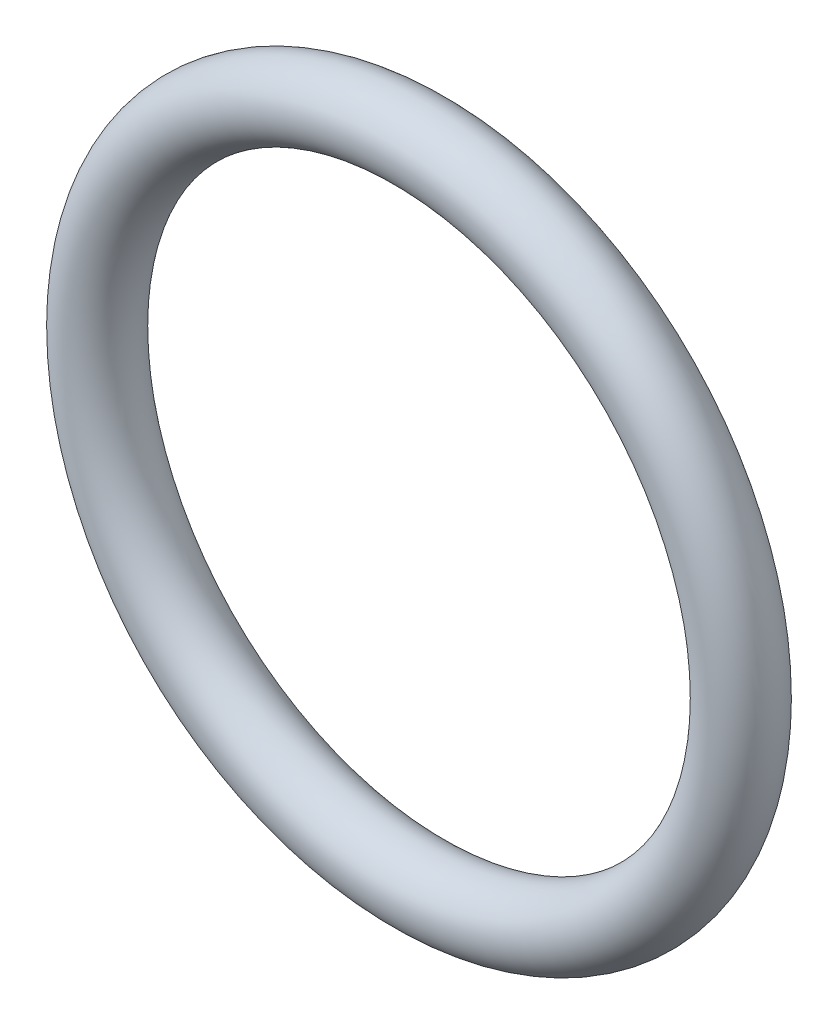
from build123d import *

# Parameters (mm, degrees)
SKETCH1_R = 1.5


with BuildPart() as part:
    # Sketch1 → Revolve1 (revolve)
    with BuildSketch(Plane(origin=(0, 0, 0), x_dir=(0, -1, 0), z_dir=(1, 0, 0)), mode=Mode.PRIVATE) as revolve1_sk:
        with Locations((13.5, 0)):
            Circle(SKETCH1_R)
    revolve(revolve1_sk.sketch.rotate(Axis((0, 0, 1.5), (0, 0, -1)), 270), axis=Axis((0, 0, 1.5), (0, 0, -1)))


solid = part.part
